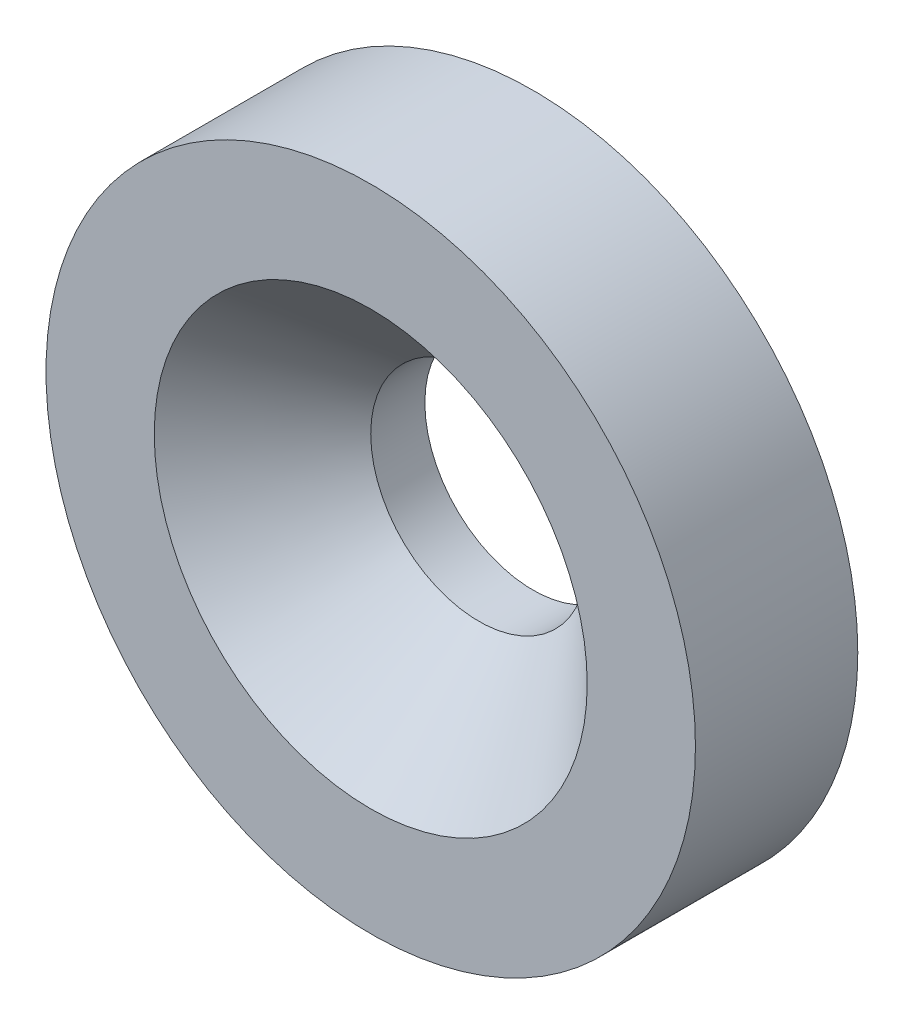
from build123d import *

# Parameters (mm, degrees)
SKETCH_1_R          = 6
EXTRUDE_1_DEPTH     = 3
SKETCH_2_R          = 2
CUT_EXTRUDE_1_DEPTH = 3
CHAMFER_1_SIZE      = 2


with BuildPart() as part:
    # 草图1 → 凸台-拉伸1 (new body)
    with BuildSketch(Plane.XY):
        Circle(SKETCH_1_R)
    extrude(amount=EXTRUDE_1_DEPTH)

    # 草图2 → 切除-拉伸1 (cut)
    with BuildSketch(Plane.XY.offset(3)):
        Circle(SKETCH_2_R)
    extrude(amount=-CUT_EXTRUDE_1_DEPTH, mode=Mode.SUBTRACT)

    # 倒角1
    chamfer_1_edges = [part.edges().sort_by_distance(p)[0] for p in [
        (-2, 0, 3),
    ]]
    chamfer(chamfer_1_edges, length=CHAMFER_1_SIZE)


solid = part.part
